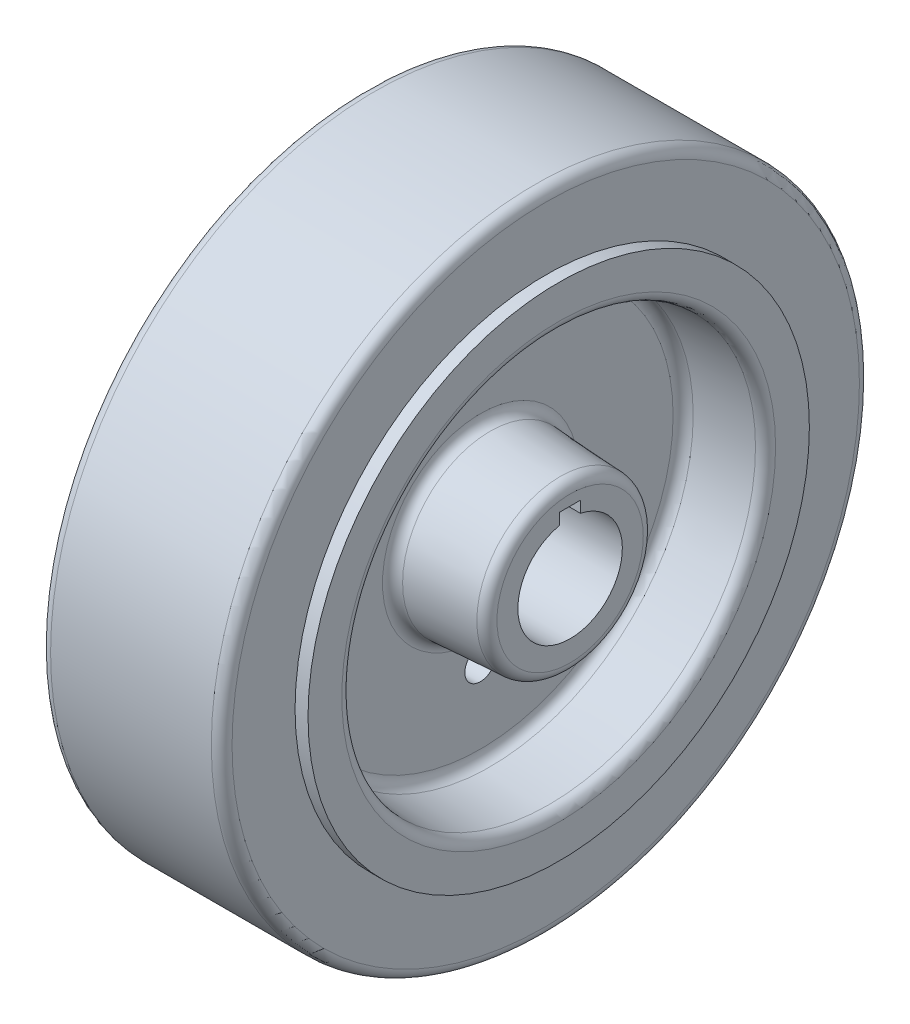
from build123d import *

# Parameters (mm, degrees)
FILLET1_R          = 2
SKETCH3_W          = 4
SKETCH3_H          = 4
CUT_EXTRUDE1_DEPTH = 99.913396527
SKETCH4_R          = 3
CUT_EXTRUDE2_DEPTH = 93.449499796


with BuildPart() as part:
    # Sketch1 → Revolve1 (revolve)
    with BuildSketch(Plane.XY, mode=Mode.PRIVATE) as revolve1_sk:
        Polygon((-17.5, -62.5), (17.5, -62.5), (17.5, -48.35), (20, -48.35), (20, -39.95), (4.9, -39.05), (4.9, -17), (22.2, -16), (22.2, -10.075), (-22.2, -10.075), (-22.2, -16), (-4.9, -17), (-4.9, -39.05), (-20, -39.95), (-20, -48.35), (-17.5, -48.35), align=None)
    revolve(revolve1_sk.sketch.rotate(Axis((0, 0, 0), (1, 0, 0)), 270), axis=Axis((0, 0, 0), (1, 0, 0)))

    # Fillet1
    fillet1_edges = [part.edges().sort_by_distance(p)[0] for p in [
        (20, 0, -39.95),
        (4.9, 0, -39.05),
        (4.9, 0, -17),
        (22.2, 0, -16),
        (-22.2, 0, -16),
        (-4.9, 0, -17),
        (-4.9, 0, -39.05),
        (-20, 0, -39.95),
        (-17.5, 0, -62.5),
        (17.5, 0, -62.5),
    ]]
    fillet(fillet1_edges, radius=FILLET1_R)

    # Sketch3 → Cut-Extrude1 (cut, through all)
    with BuildSketch(Plane.ZY.offset(22.2)):
        with Locations((0, 10.075)):
            Rectangle(SKETCH3_W, SKETCH3_H)
    extrude(amount=-CUT_EXTRUDE1_DEPTH, mode=Mode.SUBTRACT)

    # Sketch4 → Cut-Extrude2 (cut, through all)
    with BuildSketch(Plane(origin=(4.9, 0, 0), x_dir=(0, 0, -1), z_dir=(1, 0, 0))):
        with Locations((0, -22.891064409)):
            Circle(SKETCH4_R)
    extrude(amount=-CUT_EXTRUDE2_DEPTH, mode=Mode.SUBTRACT)


solid = part.part
